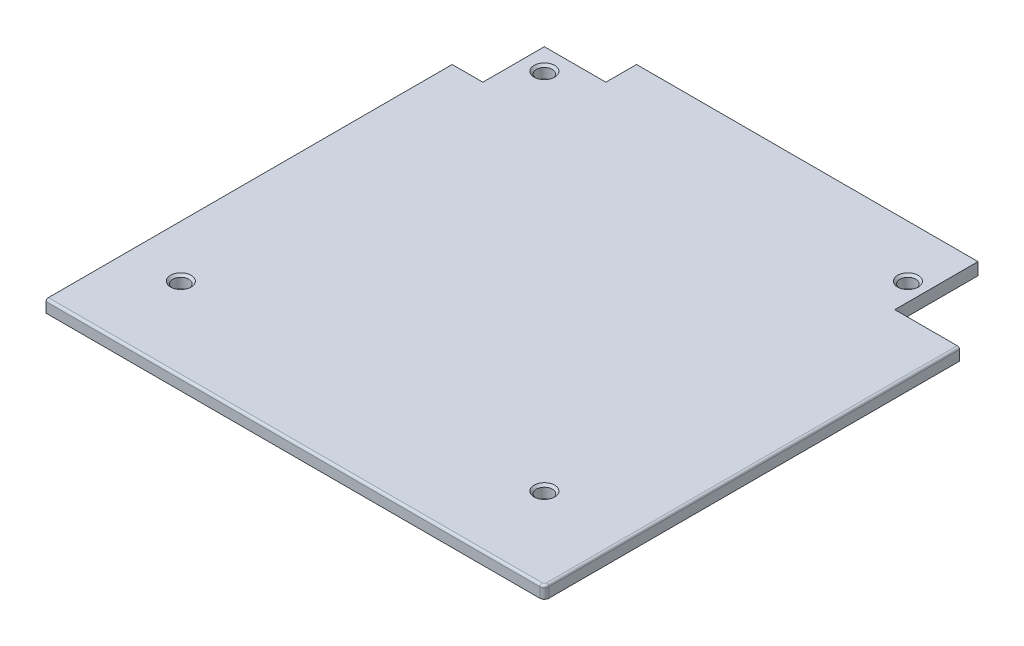
from build123d import *

# Parameters (mm, degrees)
SKETCH1_R           = 1.85
BOSS_EXTRUDE1_DEPTH = 2
CHAMFER2_SIZE       = 1.5
CUT_EXTRUDE2_START  = -2
SKETCH1_4_R         = 2.6
SKETCH1_4_R_2       = 1.85
CUT_EXTRUDE2_DEPTH  = 3.25
FILLET1_R           = 0.75


with BuildPart() as part:
    # Sketch1 → Boss-Extrude1 (new, symmetric)
    with BuildSketch(Plane(origin=(0, 0, 0), x_dir=(1, 0, 0), z_dir=(0, 1, 0))):
        with BuildLine():
            Line((-66.2, 46.15), (-76.2, 46.15))
            Line((-76.2, 46.15), (-76.2, -86.25))
            Line((-76.2, -86.25), (84.75, -86.25))
            ThreePointArc((84.75, -86.25), (85.810660172, -85.810660172), (86.25, -84.75))
            Line((86.25, -84.75), (86.25, 49.08))
            Line((86.25, 49.08), (65.15, 49.08))
            Line((65.15, 49.08), (65.15, 76.2))
            Line((65.15, 76.2), (-46.15, 76.2))
            Line((-46.15, 76.2), (-46.15, 66.2))
            Line((-46.15, 66.2), (-66.2, 66.2))
            Line((-66.2, 66.2), (-66.2, 46.15))
        make_face()
        with Locations(Location((-59.25, 59.25, 0), (0, 0, 270))):
            Circle(SKETCH1_R, mode=Mode.SUBTRACT)
        with Locations(Location((-59.25, -59.25, 0), (0, 0, 270))):
            Circle(SKETCH1_R, mode=Mode.SUBTRACT)
        with Locations(Location((59.25, -59.25, 0), (0, 0, 270))):
            Circle(SKETCH1_R, mode=Mode.SUBTRACT)
        with Locations(Location((59.25, 59.25, 0), (0, 0, 270))):
            Circle(SKETCH1_R, mode=Mode.SUBTRACT)
    extrude(amount=BOSS_EXTRUDE1_DEPTH, both=True)

    # Chamfer2
    chamfer2_edges = [part.edges().sort_by_distance(p)[0] for p in [
        (-59.25, 2, -61.1),
        (59.25, 2, -61.1),
        (59.25, 2, 57.4),
        (-59.25, 2, 57.4),
    ]]
    chamfer(chamfer2_edges, length=CHAMFER2_SIZE)

    # Sketch1<4> → Cut-Extrude2 (cut)
    # profile 1 of 4: a face of its own
    with BuildSketch(Plane(origin=(0, 0, 0), x_dir=(1, 0, 0), z_dir=(0, 1, 0)).offset(CUT_EXTRUDE2_START)):
        with Locations(Location((-59.25, 59.25, 0), (0, 0, 270))):
            Circle(SKETCH1_4_R)
        with Locations((-59.25, 59.25)):
            Circle(SKETCH1_4_R_2, mode=Mode.SUBTRACT)
    # profile 2 of 4: a face of its own
    with BuildSketch(Plane(origin=(0, 0, 0), x_dir=(1, 0, 0), z_dir=(0, 1, 0)).offset(CUT_EXTRUDE2_START)):
        with Locations(Location((-59.25, -59.25, 0), (0, 0, 270))):
            Circle(SKETCH1_4_R)
        with Locations((-59.25, -59.25)):
            Circle(SKETCH1_4_R_2, mode=Mode.SUBTRACT)
    # profile 3 of 4: a face of its own
    with BuildSketch(Plane(origin=(0, 0, 0), x_dir=(1, 0, 0), z_dir=(0, 1, 0)).offset(CUT_EXTRUDE2_START)):
        with Locations(Location((59.25, -59.25, 0), (0, 0, 270))):
            Circle(SKETCH1_4_R)
        with Locations((59.25, -59.25)):
            Circle(SKETCH1_4_R_2, mode=Mode.SUBTRACT)
    # profile 4 of 4: a face of its own
    with BuildSketch(Plane(origin=(0, 0, 0), x_dir=(1, 0, 0), z_dir=(0, 1, 0)).offset(CUT_EXTRUDE2_START)):
        with Locations(Location((59.25, 59.25, 0), (0, 0, 270))):
            Circle(SKETCH1_4_R)
        with Locations((59.25, 59.25)):
            Circle(SKETCH1_4_R_2, mode=Mode.SUBTRACT)
    extrude(amount=CUT_EXTRUDE2_DEPTH, mode=Mode.SUBTRACT)

    # Fillet1
    fillet1_edges = [part.edges().sort_by_distance(p)[0] for p in [
        (86.25, 2, 17.835),
        (4.275, 2, 86.25),
        (85.810660172, 2, 85.810660172),
    ]]
    fillet(fillet1_edges, radius=FILLET1_R)


solid = part.part
